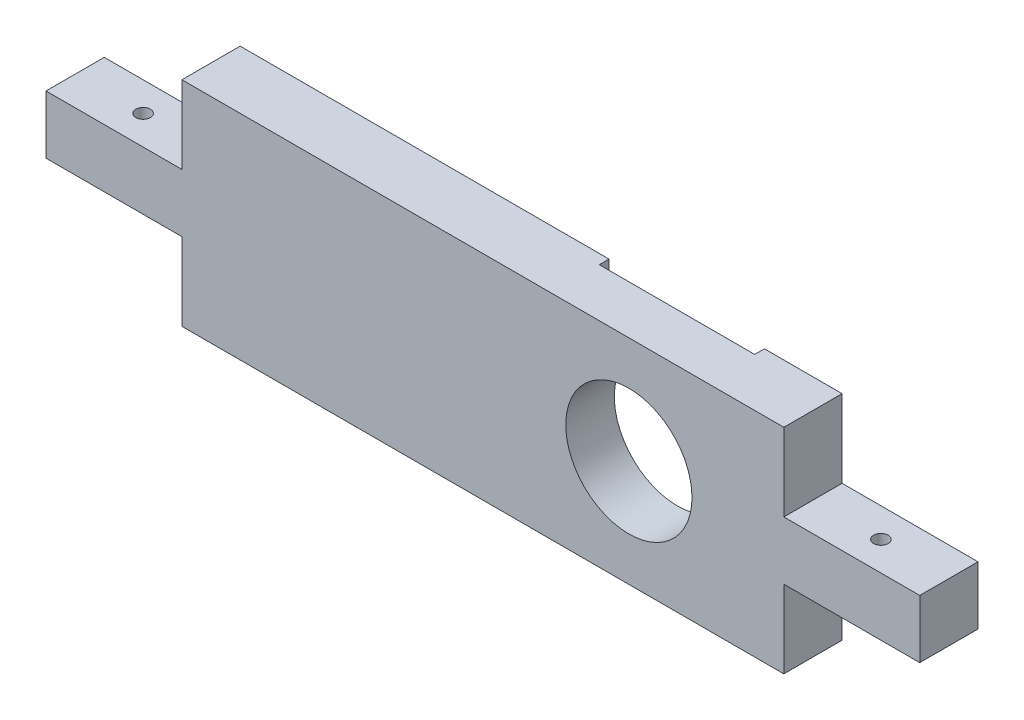
from build123d import *

# Parameters (mm, degrees)
SKETCH2_W           = 571.5
SKETCH2_H           = 139.7
BOSS_EXTRUDE2_DEPTH = 38.1
SKETCH3_W           = 88.9
SKETCH3_H           = 50.8
CUT_EXTRUDE1_DEPTH  = 590.559114933
SKETCH4_R           = 41.275
CUT_EXTRUDE2_DEPTH  = 590.559114933
SKETCH5_R           = 4.7625
CUT_EXTRUDE3_DEPTH  = 580.626664328
SKETCH6_R           = 4.7625
CUT_EXTRUDE4_DEPTH  = 580.626664328
SKETCH7_W           = 101.6
SKETCH7_H           = 6.35
CUT_EXTRUDE5_DEPTH  = 590.559114933


with BuildPart() as part:
    # Sketch2 → Boss-Extrude2 (new body)
    with BuildSketch(Plane.XY):
        with Locations((285.75, 69.85)):
            Rectangle(SKETCH2_W, SKETCH2_H)
    extrude(amount=BOSS_EXTRUDE2_DEPTH)

    # Sketch3 → Cut-Extrude1 (cut, through all)
    with BuildSketch(Plane.XY.offset(38.1)):
        with Locations((44.45, 114.3)):
            Rectangle(SKETCH3_W, SKETCH3_H)
        with Locations((527.05, 114.3)):
            Rectangle(SKETCH3_W, SKETCH3_H)
        with Locations((527.05, 25.4)):
            Rectangle(SKETCH3_W, SKETCH3_H)
        with Locations((44.45, 25.4)):
            Rectangle(SKETCH3_W, SKETCH3_H)
    extrude(amount=-CUT_EXTRUDE1_DEPTH, mode=Mode.SUBTRACT)

    # Sketch4 → Cut-Extrude2 (cut, through all)
    with BuildSketch(Plane.XY.offset(38.1)):
        with Locations((381.247583626, 69.85)):
            Circle(SKETCH4_R)
    extrude(amount=-CUT_EXTRUDE2_DEPTH, mode=Mode.SUBTRACT)

    # Sketch5 → Cut-Extrude3 (cut, through all)
    with BuildSketch(Plane(origin=(0, 50.8, 0), x_dir=(-1, 0, 0), z_dir=(0, -1, 0))):
        with Locations(Location((-44.45, -19.05, 0), (0, 0, 180))):
            Circle(SKETCH5_R)
    extrude(amount=-CUT_EXTRUDE3_DEPTH, mode=Mode.SUBTRACT)

    # Sketch6 → Cut-Extrude4 (cut, through all)
    with BuildSketch(Plane.XZ.offset(-50.8)):
        with Locations((527.05, 19.05)):
            Circle(SKETCH6_R)
    extrude(amount=-CUT_EXTRUDE4_DEPTH, mode=Mode.SUBTRACT)

    # Sketch7 → Cut-Extrude5 (cut, through all)
    with BuildSketch(Plane.XZ):
        with Locations((381, 3.175)):
            Rectangle(SKETCH7_W, SKETCH7_H)
    extrude(amount=-CUT_EXTRUDE5_DEPTH, mode=Mode.SUBTRACT)


solid = part.part
